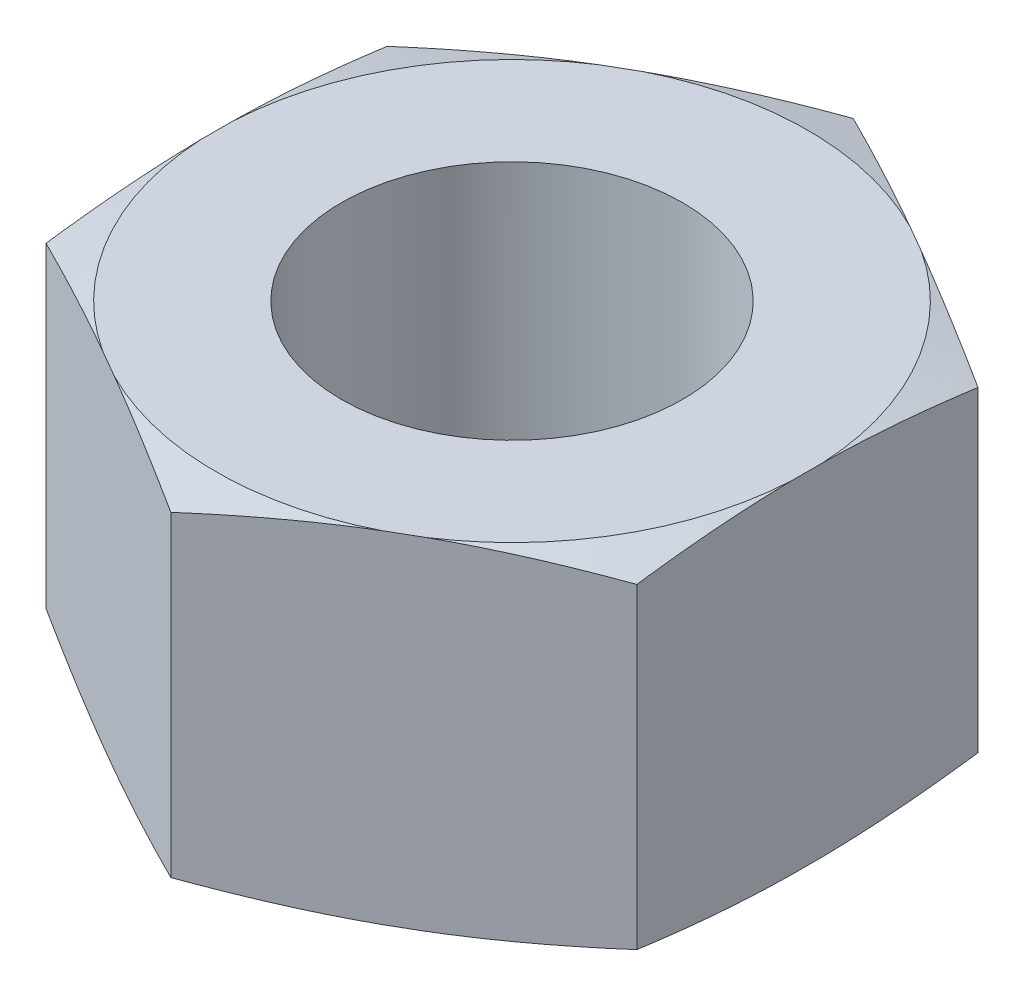
from build123d import *

# Parameters (mm, degrees)
BOSS_EXTRUDE2_DEPTH = 16
SKETCH9_R           = 8
CUT_EXTRUDE3_DEPTH  = 64


with BuildPart() as part:
    # Sketch4 → Boss-Extrude2 (new body)
    with BuildSketch(Plane(origin=(0, 0, 0), x_dir=(1, 0, 0), z_dir=(0, 1, 0))):
        Polygon((0, -16), (13.856406461, -8), (13.856406461, 8), (0, 16), (-13.856406461, 8), (-13.856406461, -8), align=None)
    extrude(amount=-BOSS_EXTRUDE2_DEPTH)

    # Sketch5 → Cut-Revolve2 (revolve, cut)
    with BuildSketch(Plane.XY):
        Polygon((-13.875900938, 0), (-18.013042907, 0), (-18.013042907, -1.135273282), align=None)
    cut_revolve2 = revolve(axis=Axis((0, 7.032369226, 0), (0, -1, 0)), mode=Mode.SUBTRACT)

    # Sketch9 → Cut-Extrude3 (cut)
    with BuildSketch(Plane.XZ.offset(16)):
        with Locations(Location((0, 0, 0), (0, 0, 270))):
            Circle(SKETCH9_R)
    extrude(amount=-CUT_EXTRUDE3_DEPTH, mode=Mode.SUBTRACT)

    # Mirror1: Cut-Revolve2 across plane
    add(cut_revolve2.mirror(Plane.ZX.offset(-8)), mode=Mode.SUBTRACT)


solid = part.part
